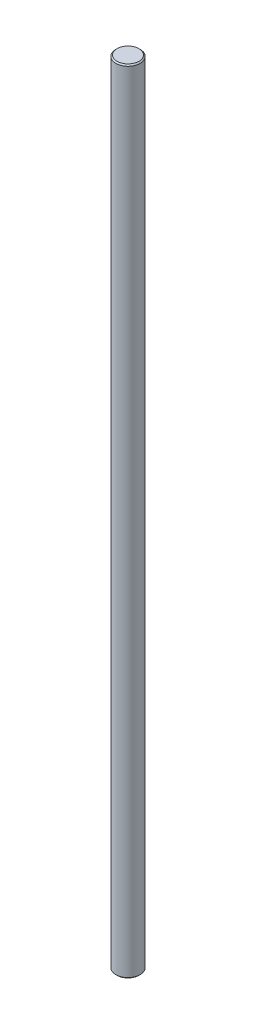
from build123d import *

# Parameters (mm, degrees)
SKETCH1_R           = 10
BOSS_EXTRUDE1_DEPTH = 650
CHAMFER1_SIZE       = 1


with BuildPart() as part:
    # Sketch1 → Boss-Extrude1 (new body)
    with BuildSketch(Plane(origin=(0, 0, 0), x_dir=(1, 0, 0), z_dir=(0, 1, 0))):
        with Locations(Location((0, 0, 0), (0, 0, 270))):
            Circle(SKETCH1_R)
    extrude(amount=BOSS_EXTRUDE1_DEPTH)

    # Chamfer1
    chamfer1_edges = [part.edges().sort_by_distance(p)[0] for p in [
        (0, 0, -10),
        (0, 650, -10),
    ]]
    chamfer(chamfer1_edges, length=CHAMFER1_SIZE)


solid = part.part
